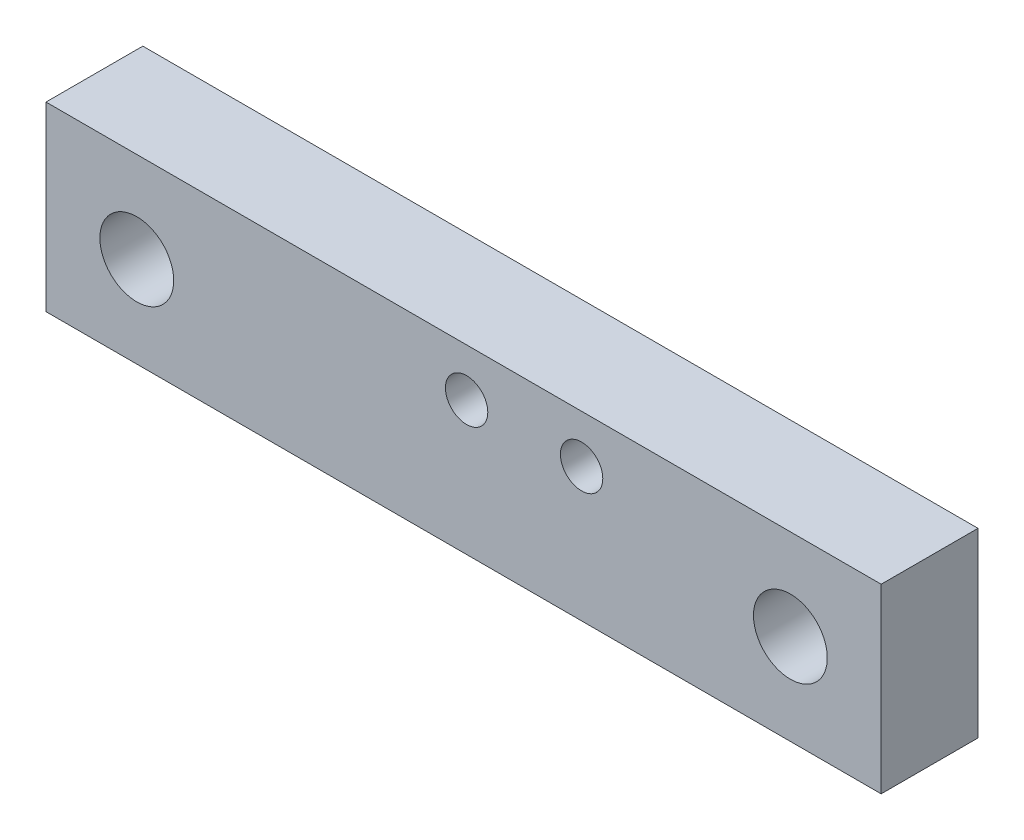
from build123d import *

# Parameters (mm, degrees)
SKETCH1_W           = 69
SKETCH1_H           = 15
SKETCH1_R           = 3.05
SKETCH1_R_2         = 1.75
BOSS_EXTRUDE1_DEPTH = 8


with BuildPart() as part:
    # Sketch1 → Boss-Extrude1 (new body)
    with BuildSketch(Plane.XY):
        Rectangle(SKETCH1_W, SKETCH1_H)
        with Locations((-27, 0)):
            Circle(SKETCH1_R, mode=Mode.SUBTRACT)
        with Locations(Location((27, 0, 0), (0, 0, 180))):
            Circle(SKETCH1_R, mode=Mode.SUBTRACT)
        with Locations((0.25, 3.55)):
            Circle(SKETCH1_R_2, mode=Mode.SUBTRACT)
        with Locations((9.75, 3.55)):
            Circle(SKETCH1_R_2, mode=Mode.SUBTRACT)
    extrude(amount=BOSS_EXTRUDE1_DEPTH)


solid = part.part
